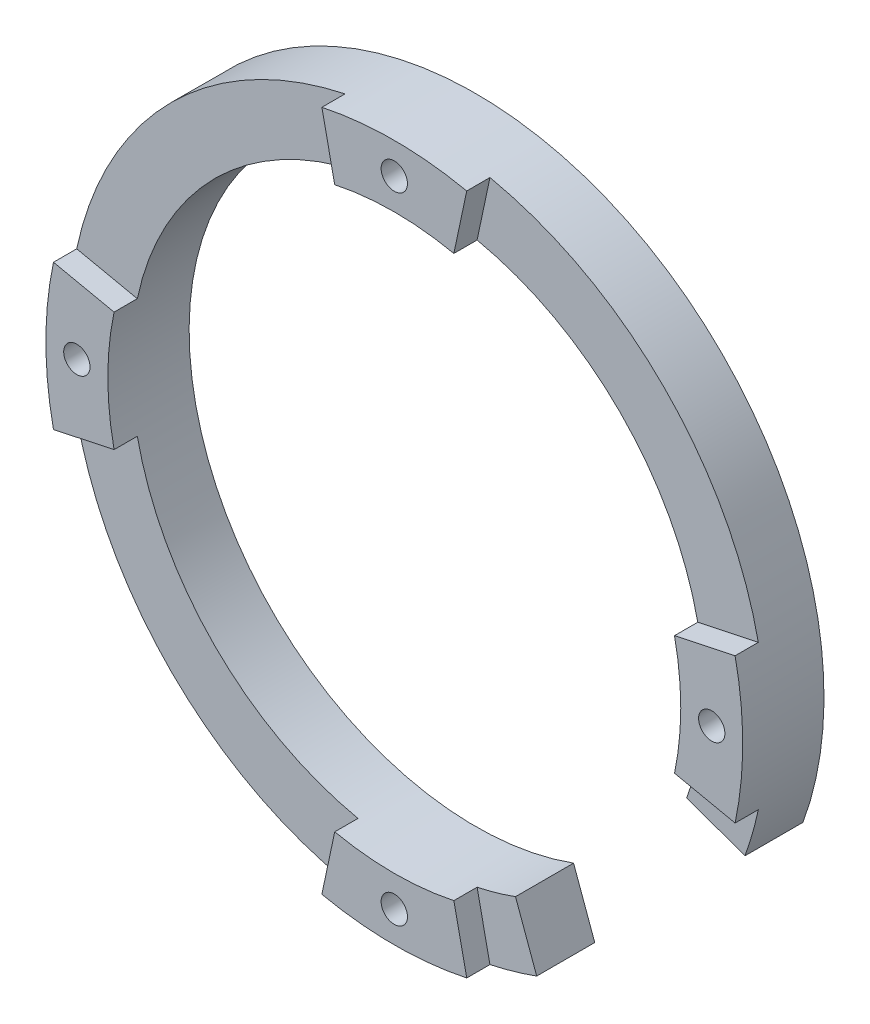
from build123d import *

# Parameters (mm, degrees)
SKETCH_1_R               = 45
SKETCH_1_R_2             = 37
SKETCH_1_R_3             = 1.7
EXTRUDE_1_DEPTH          = 10.5
CUT_EXTRUDE_START        = -3
CUT_EXTRUDE_1_DEPTH      = 3
PATTERN_CIRCULAR_1_COUNT = 4
CUT_EXTRUDE_START_2      = -13
CUT_EXTRUDE_2_DEPTH      = 13


with BuildPart() as part:
    # 草图1 → 凸台-拉伸1 (new body)
    with BuildSketch(Plane.XY):
        with Locations(Location((0, 0, 0), (0, 0, 180))):
            Circle(SKETCH_1_R)
        with Locations(Location((0, 0, 0), (0, 0, 180))):
            Circle(SKETCH_1_R_2, mode=Mode.SUBTRACT)
        with Locations(Location((41, 0, 0), (0, 0, 180))):
            Circle(SKETCH_1_R_3, mode=Mode.SUBTRACT)
        with Locations(Location((0, -41, 0), (0, 0, 180))):
            Circle(SKETCH_1_R_3, mode=Mode.SUBTRACT)
        with Locations(Location((-41, 0, 0), (0, 0, 180))):
            Circle(SKETCH_1_R_3, mode=Mode.SUBTRACT)
        with Locations(Location((0, 41, 0), (0, 0, 180))):
            Circle(SKETCH_1_R_3, mode=Mode.SUBTRACT)
    extrude(amount=EXTRUDE_1_DEPTH)

    # 草图2 → 切除-拉伸1 (cut)
    with BuildSketch(Plane.XY.offset(10.5).offset(CUT_EXTRUDE_START)):
        with BuildLine():
            Line((9.356026087, 44.016642033), (7.69273256, 36.191461227))
            ThreePointArc((7.69273256, 36.191461227), (26.162950904, 26.162950904), (36.191461227, 7.69273256))
            Line((36.191461227, 7.69273256), (44.016642033, 9.356026087))
            ThreePointArc((44.016642033, 9.356026087), (31.819805153, 31.819805153), (9.356026087, 44.016642033))
        make_face()
    cut_extrude_1 = extrude(amount=CUT_EXTRUDE_1_DEPTH, mode=Mode.SUBTRACT)

    # 阵列(圆周)1: 切除-拉伸1 ×4 about axis
    pattern_circular_1_axis = Axis((0, 0, 10.5), (0, 0, -1))
    for i in range(1, PATTERN_CIRCULAR_1_COUNT):
        add(cut_extrude_1.rotate(pattern_circular_1_axis, i * 360 / PATTERN_CIRCULAR_1_COUNT), mode=Mode.SUBTRACT)

    # 草图3 → 切除-拉伸2 (cut)
    with BuildSketch(Plane.XY.offset(7.5).offset(CUT_EXTRUDE_START_2)):
        with BuildLine():
            Line((34.768626969, -12.654745303), (42.286167935, -15.39090645))
            ThreePointArc((42.286167935, -15.39090645), (31.819805153, -31.819805153), (15.39090645, -42.286167935))
            Line((15.39090645, -42.286167935), (12.654745303, -34.768626969))
            ThreePointArc((12.654745303, -34.768626969), (26.162950904, -26.162950904), (34.768626969, -12.654745303))
        make_face()
    extrude(amount=CUT_EXTRUDE_2_DEPTH, mode=Mode.SUBTRACT)


solid = part.part
